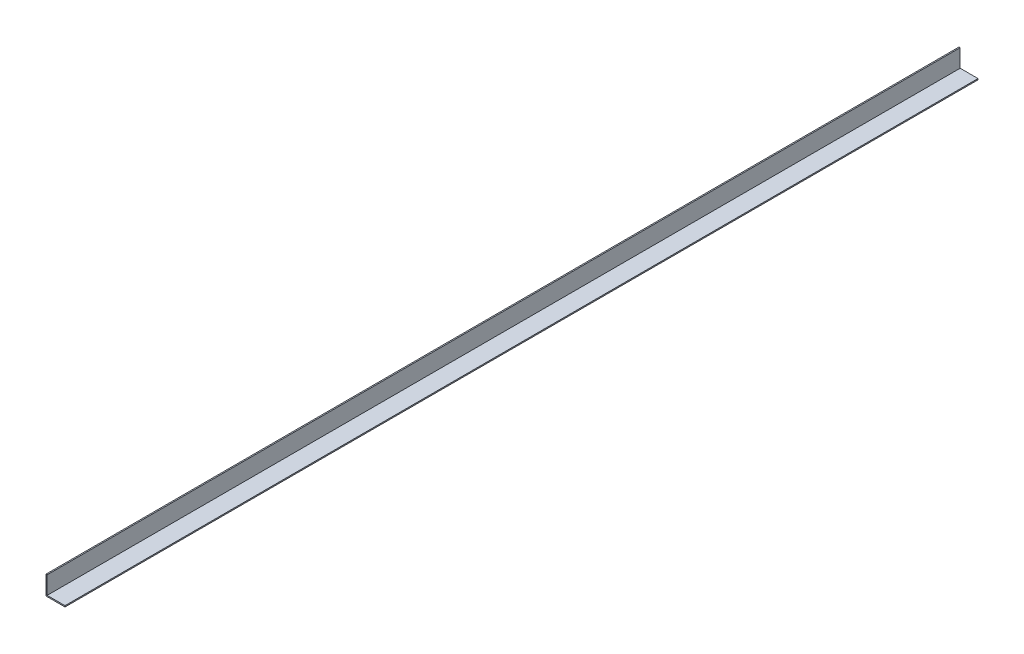
from build123d import *

# Parameters (mm, degrees)
SALIENTE_EXTRUIR1_DEPTH = 6100


with BuildPart() as part:
    # Croquis1 → Saliente-Extruir1 (new body)
    with BuildSketch(Plane.XY):
        Polygon((0, 127), (0, 0), (127, 0), (127, 7.94), (7.94, 7.94), (7.94, 127), align=None)
    extrude(amount=-SALIENTE_EXTRUIR1_DEPTH)


solid = part.part
